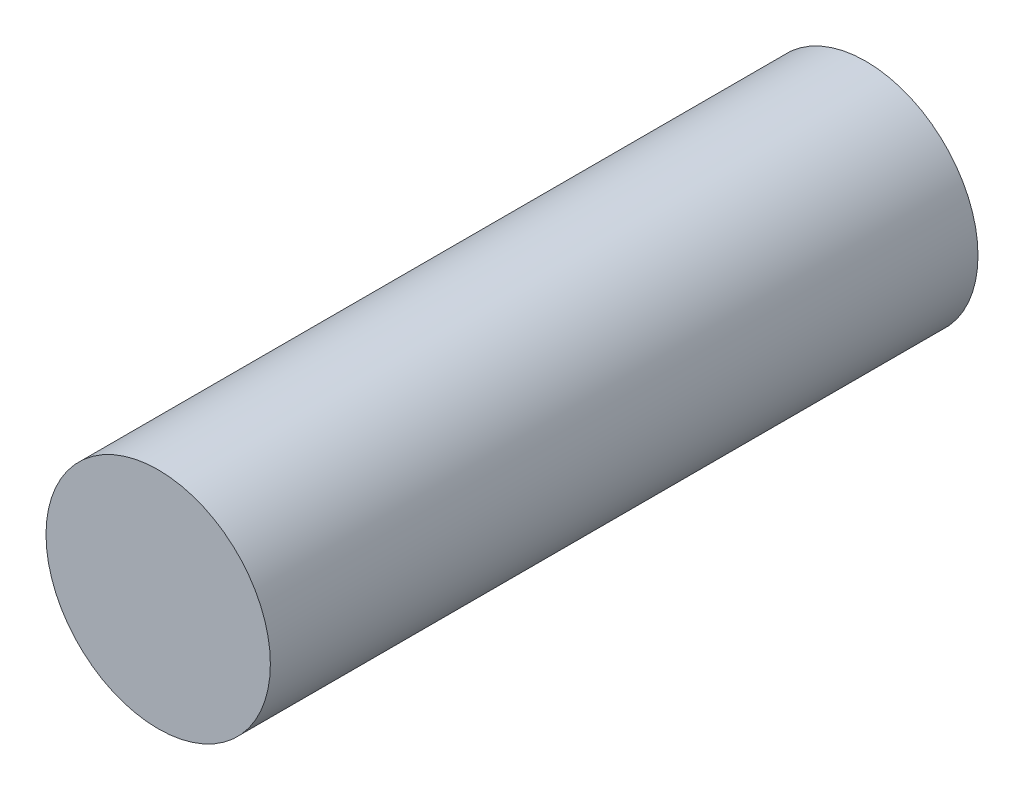
from build123d import *

# Parameters (mm, degrees)
SKETCH1_R     = 6.5
BATTERY_DEPTH = 20.5


with BuildPart() as part:
    # Sketch1 → battery (new, symmetric)
    with BuildSketch(Plane.XY):
        Circle(SKETCH1_R)
    extrude(amount=BATTERY_DEPTH, both=True)


solid = part.part
